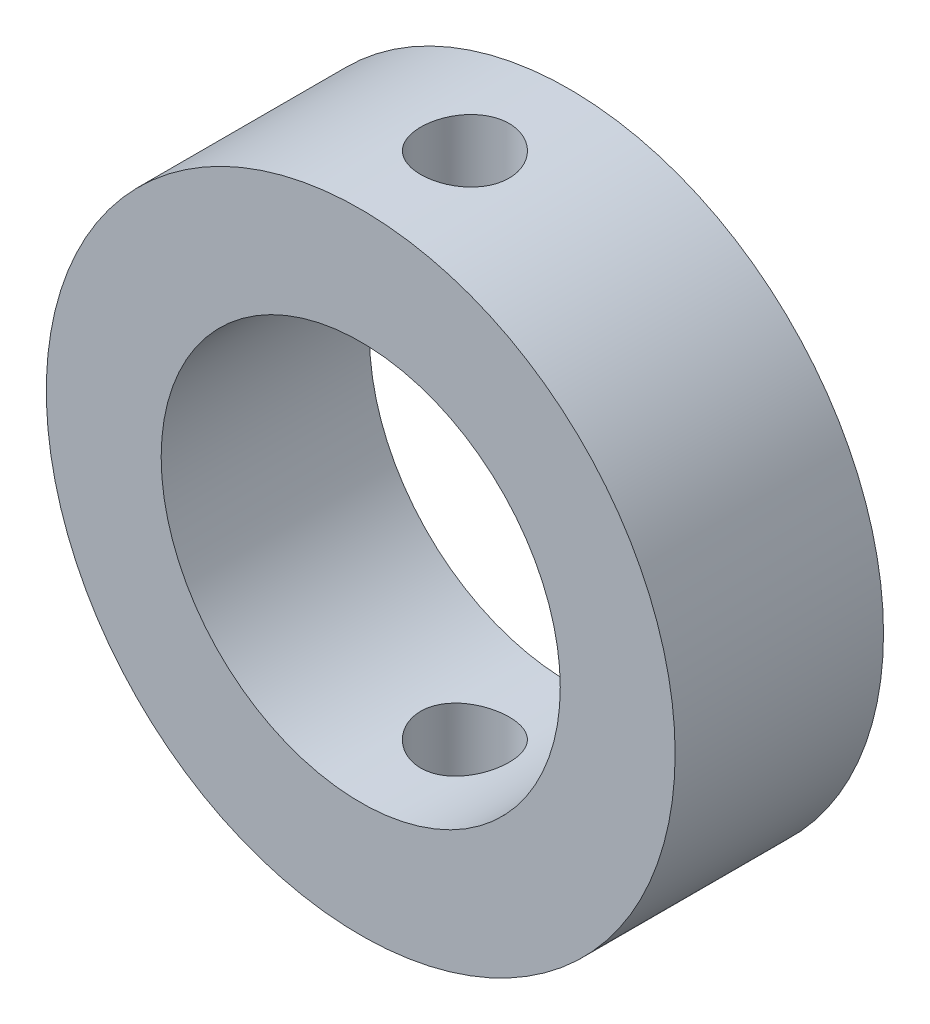
from build123d import *

# Parameters (mm, degrees)
SKETCH1_R               = 57.337985499
SKETCH1_R_2             = 36.391073902
BOSS_EXTRUDE2_DEPTH     = 38
CUT_EXTRUDE1_DEPTH      = 90.550483875
CUT_EXTRUDE1_DEPTH_BACK = 90.550483875
SKETCH2_R               = 8.06939109


with BuildPart() as part:
    # Sketch1 → Boss-Extrude2 (new body)
    with BuildSketch(Plane.XY):
        Circle(SKETCH1_R)
        Circle(SKETCH1_R_2, mode=Mode.SUBTRACT)
    extrude(amount=BOSS_EXTRUDE2_DEPTH)

    # Sketch2 → Cut-Extrude1 (cut, two sides: drawn at the far end of the back side and taken through both)
    with BuildSketch(Plane(origin=(0, 0, 0), x_dir=(1, 0, 0), z_dir=(0, 1, 0)).offset(-CUT_EXTRUDE1_DEPTH_BACK)):
        with Locations(Location((0, -19, 0), (0, 0, 270))):
            Circle(SKETCH2_R)
    extrude(amount=CUT_EXTRUDE1_DEPTH + CUT_EXTRUDE1_DEPTH_BACK, mode=Mode.SUBTRACT)


solid = part.part
